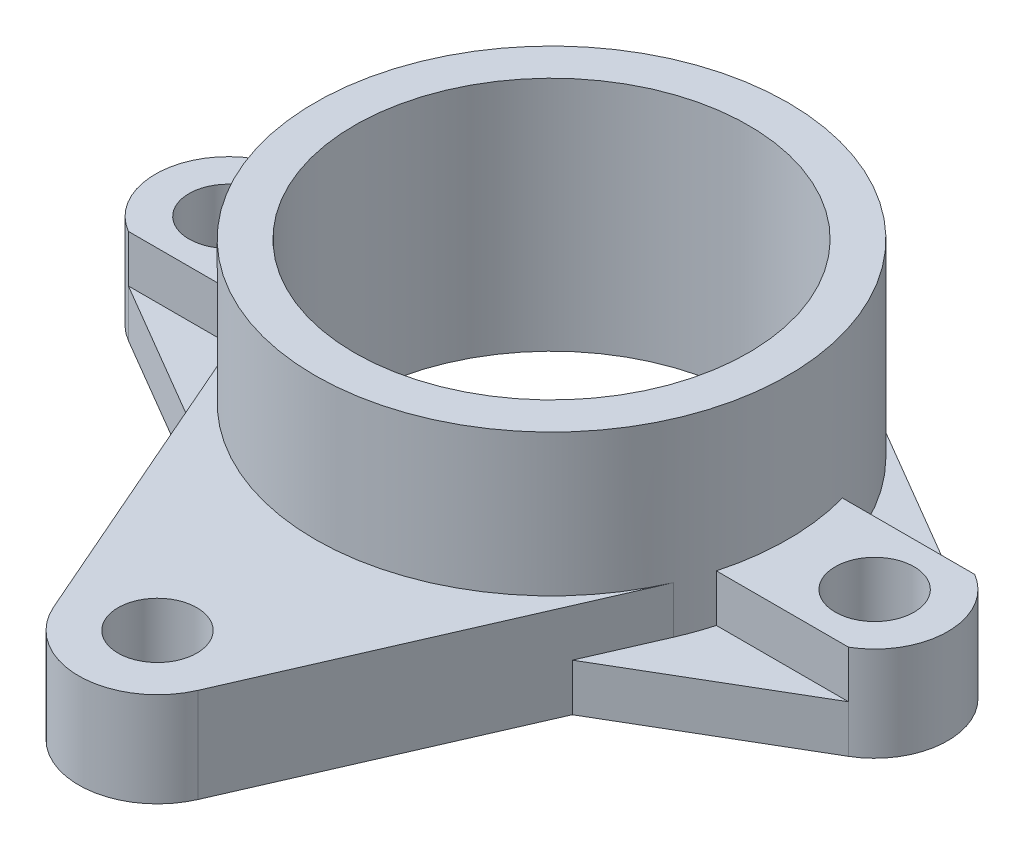
from build123d import *

# Parameters (mm, degrees)
BOSS_EXTRUDE1_DEPTH        = 6
BOSS_EXTRUDE2_DEPTH        = 6
BOSS_EXTRUDE3_START        = 18
SKETCH3_R                  = 30
BOSS_EXTRUDE3_DEPTH        = 18
F_10_0_10_DIAMETER_HOLE1_D = 10
M45_CLEARANCE_HOLE1_D      = 50


with BuildPart() as part:
    # Sketch1 → Boss-Extrude1 (new body)
    with BuildSketch(Plane(origin=(0, 12, 0), x_dir=(1, 0, 0), z_dir=(0, 1, 0))):
        with BuildLine():
            Line((-45.687618347, -8), (-28.91366459, -8))
            ThreePointArc((-28.91366459, -8), (-28.275380984, -10.025109984), (-27.49545417, -12))
            Line((-27.49545417, -12), (-9.16515139, -54))
            ThreePointArc((-9.16515139, -54), (0, -60), (9.16515139, -54))
            Line((9.16515139, -54), (27.49545417, -12))
            ThreePointArc((27.49545417, -12), (28.275380984, -10.025109984), (28.91366459, -8))
            Line((28.91366459, -8), (45.687618347, -8))
            ThreePointArc((45.687618347, -8), (50.272203932, 0), (45.687618347, 8))
            Line((45.687618347, 8), (28.91366459, 8))
            ThreePointArc((28.91366459, 8), (0, 30), (-28.91366459, 8))
            Line((-28.91366459, 8), (-45.687618347, 8))
            ThreePointArc((-45.687618347, 8), (-50.272203932, 0), (-45.687618347, -8))
        make_face()
    extrude(amount=-BOSS_EXTRUDE1_DEPTH)

    # Sketch2 → Boss-Extrude2 (add)
    with BuildSketch(Plane.XZ.offset(-6)):
        with BuildLine():
            Line((-15.16668005, -25.883813789), (-45.687618347, -8))
            ThreePointArc((-45.687618347, -8), (-50.272203932, 0), (-45.687618347, 8))
            Line((-45.687618347, 8), (-23.590216691, 20.948023176))
            Line((-23.590216691, 20.948023176), (-9.16515139, 54))
            ThreePointArc((-9.16515139, 54), (0, 60), (9.16515139, 54))
            Line((9.16515139, 54), (23.590216691, 20.948023176))
            Line((23.590216691, 20.948023176), (45.687618347, 8))
            ThreePointArc((45.687618347, 8), (50.272203932, 0), (45.687618347, -8))
            Line((45.687618347, -8), (15.16668005, -25.883813789))
            ThreePointArc((15.16668005, -25.883813789), (0, -30), (-15.16668005, -25.883813789))
        make_face()
    extrude(amount=BOSS_EXTRUDE2_DEPTH)

    # Sketch3 → Boss-Extrude3 (add)
    with BuildSketch(Plane(origin=(0, 12, 0), x_dir=(-1, 0, 0), z_dir=(0, 1, 0)).offset(BOSS_EXTRUDE3_START)):
        with Locations(Location((0, 0, 0), (0, 0, 90))):
            Circle(SKETCH3_R)
    extrude(amount=-BOSS_EXTRUDE3_DEPTH)

    # Ø10.0 (10) Diameter Hole1 (through all)
    with Locations(Plane(origin=(0, 12, 0), x_dir=(1, 0, 0), z_dir=(0, 1, 0))):
        with Locations((-41, 0), (41, 0), (0, -50)):
            Hole(F_10_0_10_DIAMETER_HOLE1_D / 2)

    # M45 Clearance Hole1 (through all)
    with Locations(Plane(origin=(0, 30, 0), x_dir=(1, 0, 0), z_dir=(0, 1, 0))):
        with Locations((0, 0)):
            Hole(M45_CLEARANCE_HOLE1_D / 2)


solid = part.part
